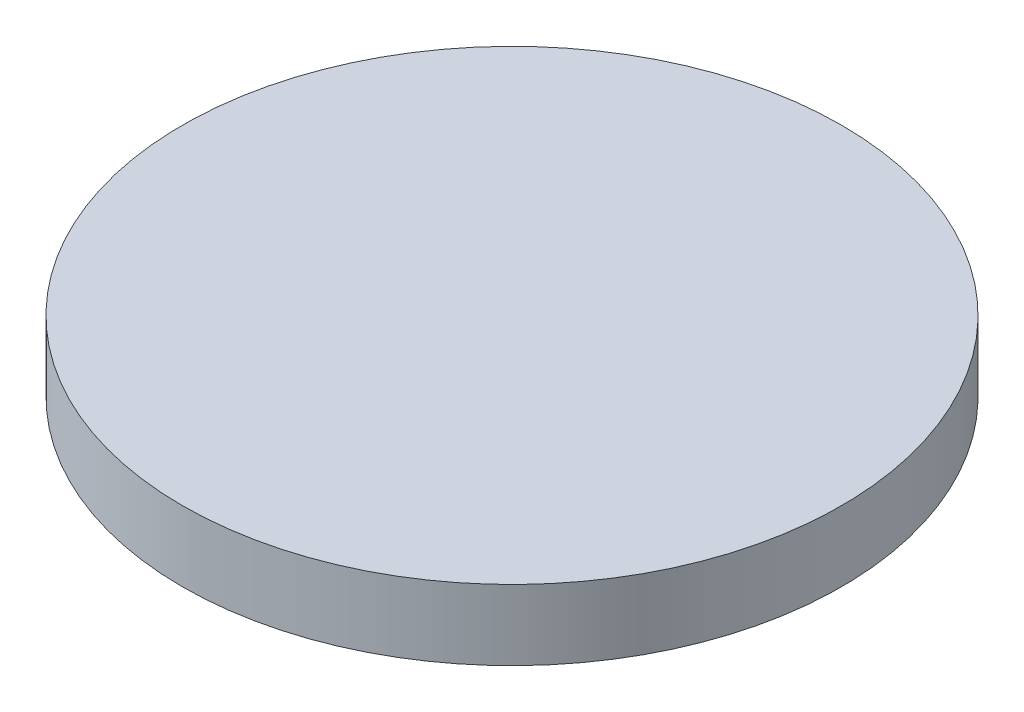
from build123d import *

# Parameters (mm, degrees)
ESQUISSE1_R        = 7.5
BOSS_EXTRU_1_DEPTH = 1.6


with BuildPart() as part:
    # Esquisse1 → Boss.-Extru.1 (new body)
    with BuildSketch(Plane(origin=(0, 0, 0), x_dir=(1, 0, 0), z_dir=(0, 1, 0))):
        with Locations(Location((0, 0, 0), (0, 0, 270))):
            Circle(ESQUISSE1_R)
    extrude(amount=BOSS_EXTRU_1_DEPTH)


solid = part.part
